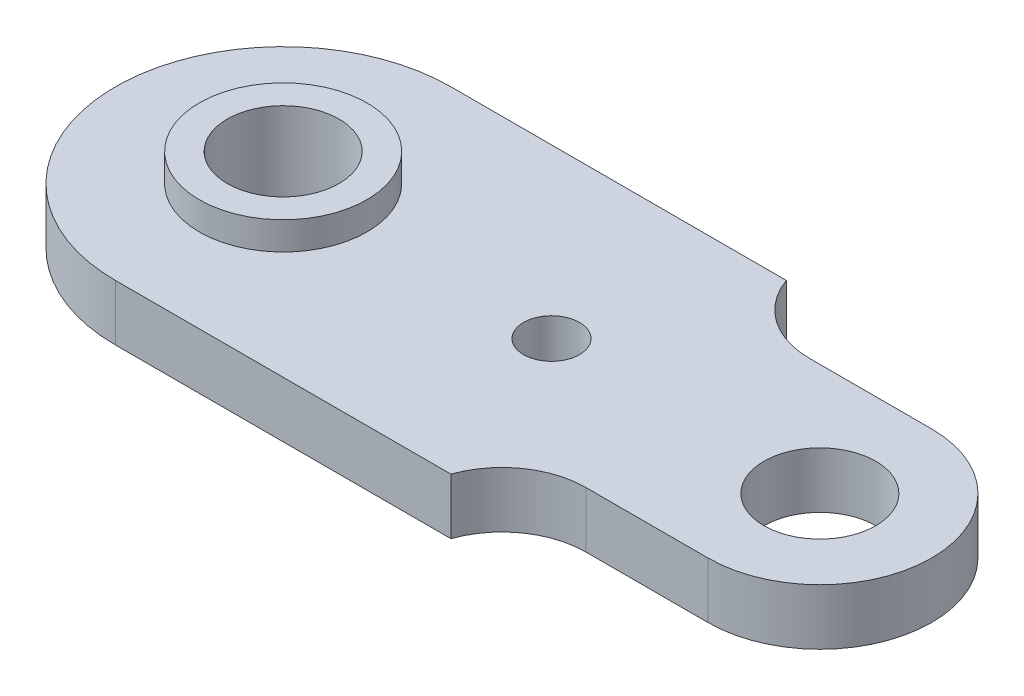
from build123d import *

# Parameters (mm, degrees)
BOSS_EXTRUDE1_DEPTH = 10
SKETCH2_R           = 15
BOSS_EXTRUDE2_DEPTH = 5
SKETCH3_R           = 10
CUT_EXTRUDE1_DEPTH  = 121.751811581
SKETCH4_R           = 5
CUT_EXTRUDE2_DEPTH  = 121.233106922
SKETCH5_R           = 10
CUT_EXTRUDE3_DEPTH  = 121.233106922


with BuildPart() as part:
    # Sketch1 → Boss-Extrude1 (new body)
    with BuildSketch(Plane(origin=(0, 0, 0), x_dir=(1, 0, 0), z_dir=(0, 1, 0))):
        with BuildLine():
            Line((60, 30), (0, 30))
            ThreePointArc((0, 30), (-30, 0), (0, -30))
            Line((0, -30), (60, -30))
            ThreePointArc((60, -30), (65.481881586, -22.752551286), (74.142135624, -20))
            Line((74.142135624, -20), (96, -20))
            ThreePointArc((96, -20), (116, 0), (96, 20))
            Line((96, 20), (74.142135624, 20))
            ThreePointArc((74.142135624, 20), (65.481881586, 22.752551286), (60, 30))
        make_face()
    extrude(amount=BOSS_EXTRUDE1_DEPTH)

    # Sketch2 → Boss-Extrude2 (add)
    with BuildSketch(Plane(origin=(0, 10, 0), x_dir=(1, 0, 0), z_dir=(0, 1, 0))):
        with Locations(Location((0, 0, 0), (0, 0, 270))):
            Circle(SKETCH2_R)
    extrude(amount=BOSS_EXTRUDE2_DEPTH)

    # Sketch3 → Cut-Extrude1 (cut, through all)
    with BuildSketch(Plane(origin=(0, 15, 0), x_dir=(1, 0, 0), z_dir=(0, 1, 0))):
        with Locations(Location((0, 0, 0), (0, 0, 270))):
            Circle(SKETCH3_R)
    extrude(amount=-CUT_EXTRUDE1_DEPTH, mode=Mode.SUBTRACT)

    # Sketch4 → Cut-Extrude2 (cut, through all)
    with BuildSketch(Plane(origin=(0, 10, 0), x_dir=(1, 0, 0), z_dir=(0, 1, 0))):
        with Locations(Location((48, 0, 0), (0, 0, 270))):
            Circle(SKETCH4_R)
    extrude(amount=-CUT_EXTRUDE2_DEPTH, mode=Mode.SUBTRACT)

    # Sketch5 → Cut-Extrude3 (cut, through all)
    with BuildSketch(Plane(origin=(0, 10, 0), x_dir=(1, 0, 0), z_dir=(0, 1, 0))):
        with Locations(Location((96, 0, 0), (0, 0, 270))):
            Circle(SKETCH5_R)
    extrude(amount=-CUT_EXTRUDE3_DEPTH, mode=Mode.SUBTRACT)


solid = part.part
